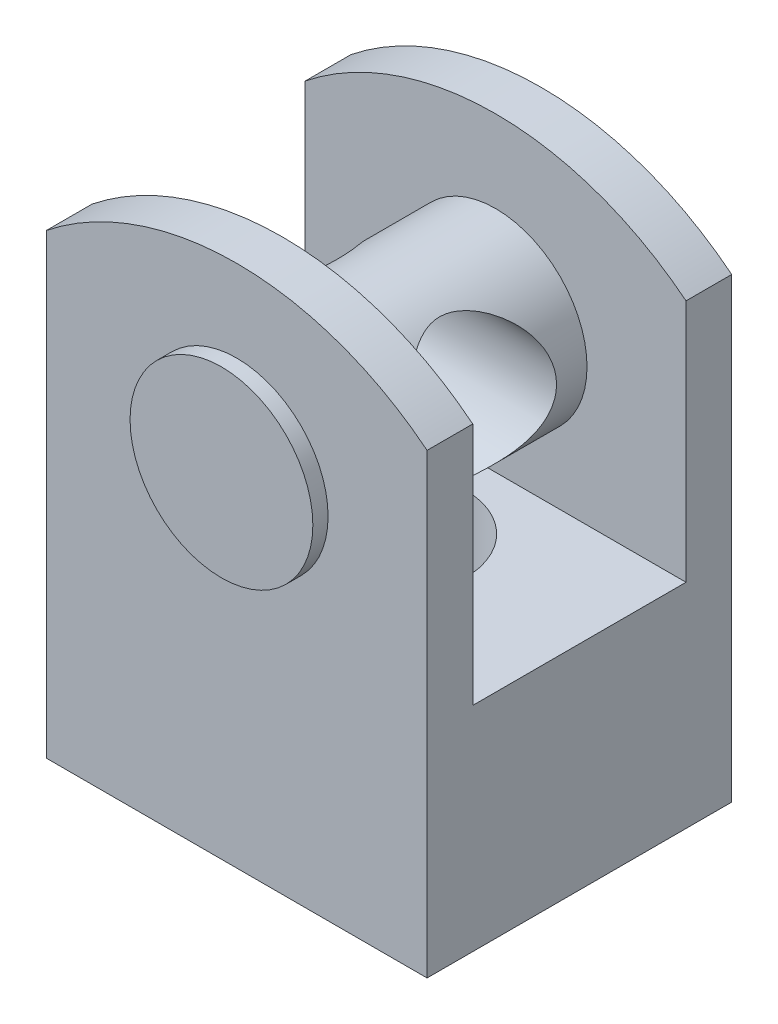
from build123d import *

# Parameters (mm, degrees)
SKETCH1_R                = 5
BOSS_EXTRUDE1_DEPTH      = 10
CUT_EXTRUDE1_DEPTH       = 34.179441681
CUT_EXTRUDE1_DEPTH_BACK  = 34.179441681
BOSS_EXTRUDE2_DEPTH      = 1
BOSS_EXTRUDE2_DEPTH_BACK = 21
SKETCH4_R                = 6
SKETCH5_R                = 5
CUT_EXTRUDE3_DEPTH       = 7.5
SKETCH6_R                = 5
CUT_EXTRUDE4_DEPTH       = 15


with BuildPart() as part:
    # Sketch1 → Boss-Extrude1 (new, symmetric)
    with BuildSketch(Plane.XY):
        with BuildLine():
            Line((-12.5, 15), (-12.5, -15))
            Line((-12.5, -15), (12.5, -15))
            Line((12.5, -15), (12.5, 15))
            ThreePointArc((12.5, 15), (0, 19.387505004), (-12.5, 15))
        make_face()
        with Locations((0, 8)):
            Circle(SKETCH1_R, mode=Mode.SUBTRACT)
    extrude(amount=BOSS_EXTRUDE1_DEPTH, both=True)

    # Sketch2 → Cut-Extrude1 (cut, two sides: drawn at the far end of the back side and taken through both)
    with BuildSketch(Plane(origin=(12.5, 0, 0), x_dir=(0, 0, -1), z_dir=(1, 0, 0)).offset(-CUT_EXTRUDE1_DEPTH_BACK)):
        Polygon((0, -1), (-7, -1), (-7, 28.013491334), (7, 28.013491334), (7, -1), align=None)
    extrude(amount=CUT_EXTRUDE1_DEPTH + CUT_EXTRUDE1_DEPTH_BACK, mode=Mode.SUBTRACT)

    # Sketch4 → Boss-Extrude2 (add, two sides: drawn at the far end of the back side and taken through both)
    with BuildSketch(Plane.XY.offset(10).offset(-BOSS_EXTRUDE2_DEPTH_BACK)):
        with Locations((0, 8)):
            Circle(SKETCH4_R)
    extrude(amount=BOSS_EXTRUDE2_DEPTH + BOSS_EXTRUDE2_DEPTH_BACK)

    # Sketch5 → Cut-Extrude3 (cut, symmetric)
    with BuildSketch(Plane(origin=(0, 0, 0), x_dir=(0, 0, -1), z_dir=(1, 0, 0))):
        with Locations((0, 8)):
            Circle(SKETCH5_R)
    extrude(amount=CUT_EXTRUDE3_DEPTH, both=True, mode=Mode.SUBTRACT)

    # Sketch6 → Cut-Extrude4 (cut)
    with BuildSketch(Plane.XZ.offset(15)):
        with Locations(Location((0, 0, 0), (0, 0, 270))):
            Circle(SKETCH6_R)
    extrude(amount=-CUT_EXTRUDE4_DEPTH, mode=Mode.SUBTRACT)


solid = part.part
